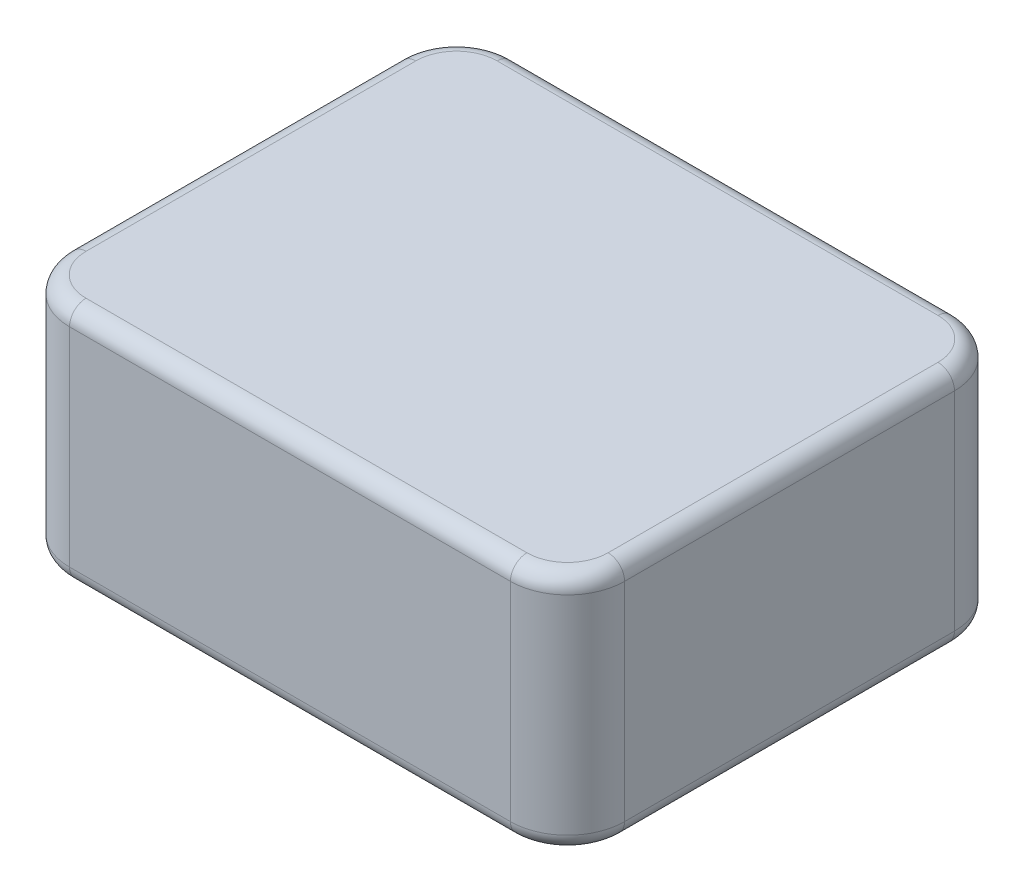
from build123d import *

# Parameters (mm, degrees)
EXTRUDE1_DEPTH = 48.26
FILLET1_R      = 3.302


with BuildPart() as part:
    # Sketch2 → Extrude1 (new body)
    with BuildSketch(Plane(origin=(0, 0, 0), x_dir=(1, 0, 0), z_dir=(0, 1, 0))):
        with BuildLine():
            Line((11.43, 0), (99.695, 0))
            ThreePointArc((99.695, 0), (107.777230509, 3.347769491), (111.125, 11.43))
            Line((111.125, 11.43), (111.125, 77.47))
            ThreePointArc((111.125, 77.47), (107.777230509, 85.552230509), (99.695, 88.9))
            Line((99.695, 88.9), (11.43, 88.9))
            ThreePointArc((11.43, 88.9), (3.347769491, 85.552230509), (0, 77.47))
            Line((0, 77.47), (0, 11.43))
            ThreePointArc((0, 11.43), (3.347769491, 3.347769491), (11.43, 0))
        make_face()
    extrude(amount=EXTRUDE1_DEPTH)

    # Fillet1
    fillet1_edges = [part.edges().sort_by_distance(p)[0] for p in [
        (3.347769491, 48.26, -3.347769491),
        (0, 0, -44.45),
        (3.347769491, 0, -85.552230509),
        (55.5625, 48.26, 0),
        (107.777230509, 48.26, -3.347769491),
        (111.125, 48.26, -44.45),
        (107.777230509, 48.26, -85.552230509),
        (55.5625, 48.26, -88.9),
        (3.347769491, 48.26, -85.552230509),
        (0, 48.26, -44.45),
        (55.5625, 0, -88.9),
        (107.777230509, 0, -85.552230509),
        (111.125, 0, -44.45),
        (107.777230509, 0, -3.347769491),
        (55.5625, 0, 0),
        (3.347769491, 0, -3.347769491),
    ]]
    fillet(fillet1_edges, radius=FILLET1_R)


solid = part.part
